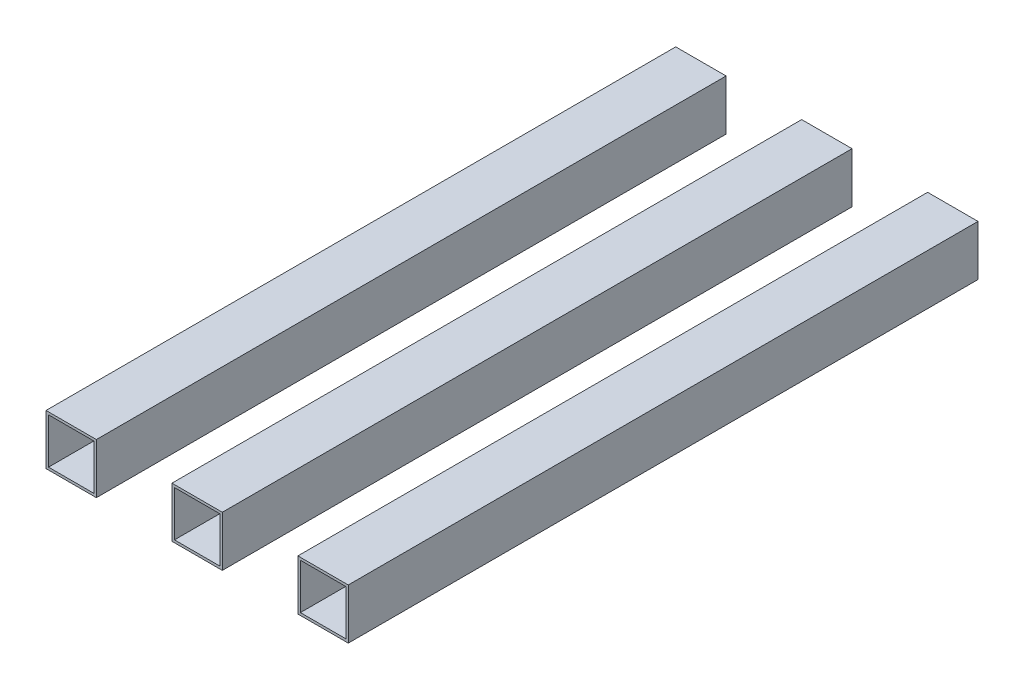
from build123d import *

# Parameters (mm, degrees)
SKETCH_1_W      = 40
SKETCH_1_H      = 40
SKETCH_1_W_2    = 36
SKETCH_1_H_2    = 36
EXTRUDE_1_DEPTH = 500
SKETCH_2_W      = 40
SKETCH_2_H      = 40
SKETCH_2_W_2    = 36
SKETCH_2_H_2    = 36
EXTRUDE_2_DEPTH = 500
SKETCH_3_W      = 40
SKETCH_3_H      = 40
SKETCH_3_W_2    = 36
SKETCH_3_H_2    = 36
EXTRUDE_3_DEPTH = 500


with BuildPart() as part:
    # Эскиз1 → Бобышка-Вытянуть1 (new body)
    with BuildSketch(Plane.XY):
        with Locations((-100, 0)):
            Rectangle(SKETCH_1_W, SKETCH_1_H)
        with Locations((-100, 0)):
            Rectangle(SKETCH_1_W_2, SKETCH_1_H_2, mode=Mode.SUBTRACT)
    extrude(amount=EXTRUDE_1_DEPTH)


with BuildPart() as body_2:
    # Эскиз2 → Бобышка-Вытянуть2 (new body)
    with BuildSketch(Plane.XY):
        Rectangle(SKETCH_2_W, SKETCH_2_H)
        Rectangle(SKETCH_2_W_2, SKETCH_2_H_2, mode=Mode.SUBTRACT)
    extrude(amount=EXTRUDE_2_DEPTH)


with BuildPart() as body_3:
    # Эскиз3 → Бобышка-Вытянуть3 (new body)
    with BuildSketch(Plane.XY):
        with Locations((100, 0)):
            Rectangle(SKETCH_3_W, SKETCH_3_H)
        with Locations((100, 0)):
            Rectangle(SKETCH_3_W_2, SKETCH_3_H_2, mode=Mode.SUBTRACT)
    extrude(amount=EXTRUDE_3_DEPTH)


solid = Compound([part.part, body_2.part, body_3.part])
